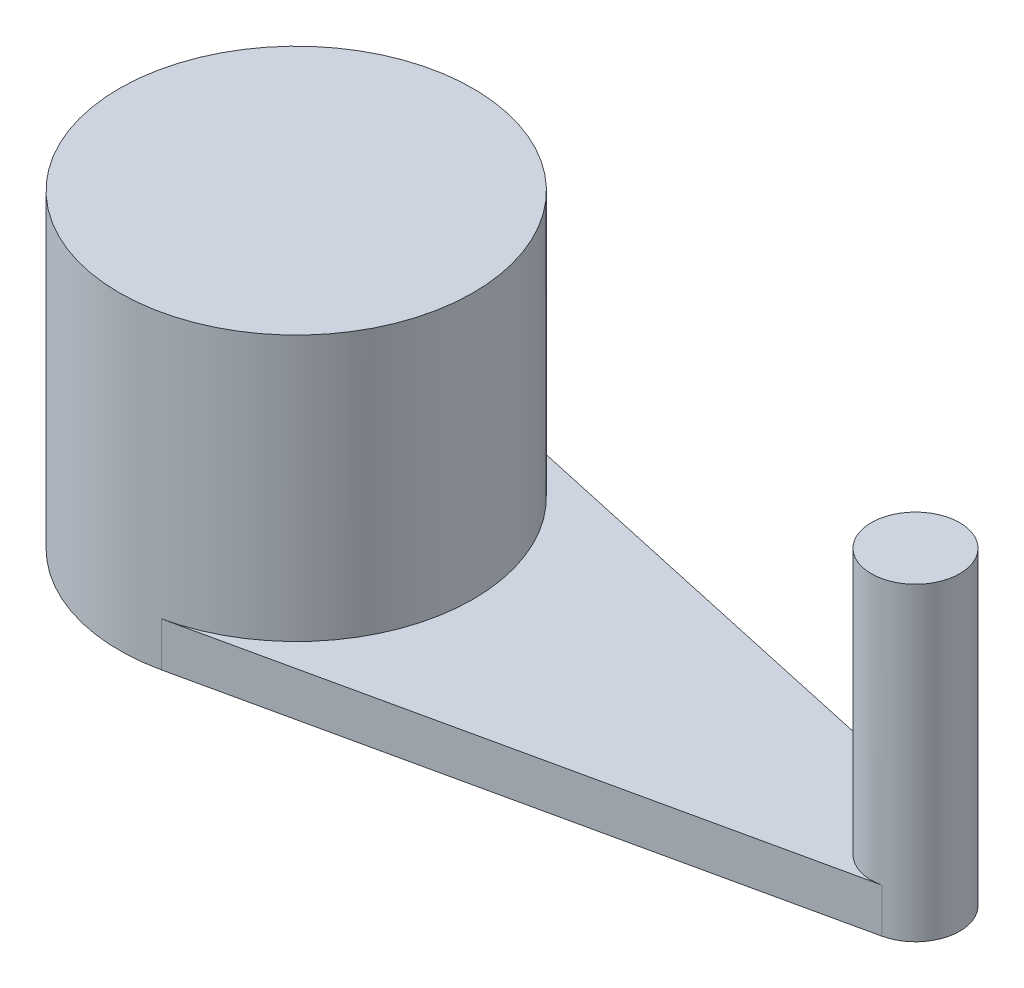
from build123d import *

# Parameters (mm, degrees)
EXTRUDE_1_DEPTH = 5
SKETCH_2_R      = 20
SKETCH_2_R_2    = 5
EXTRUDE_2_DEPTH = 30


with BuildPart() as part:
    # 草图1 → 凸台-拉伸1 (new body)
    with BuildSketch(Plane(origin=(0, 0, 0), x_dir=(1, 0, 0), z_dir=(0, 1, 0))):
        with BuildLine():
            Line((71.071428571, 4.883855118), (4.285714272, 19.535420476))
            ThreePointArc((4.285714272, 19.535420476), (-20, 1.6e-07), (4.28571396, -19.535420545))
            Line((4.28571396, -19.535420545), (71.071428571, -4.883855118))
            ThreePointArc((71.071428571, -4.883855118), (75, 0), (71.071428571, 4.883855118))
        make_face()
    extrude(amount=EXTRUDE_1_DEPTH)

    # 草图2 → 凸台-拉伸2 (add)
    with BuildSketch(Plane(origin=(0, 5, 0), x_dir=(1, 0, 0), z_dir=(0, 1, 0))):
        with Locations(Location((0, 0, 0), (0, 0, 77.626374884))):
            Circle(SKETCH_2_R)
        with Locations(Location((70, 0, 0), (0, 0, 77.626374884))):
            Circle(SKETCH_2_R_2)
    extrude(amount=EXTRUDE_2_DEPTH)


solid = part.part
